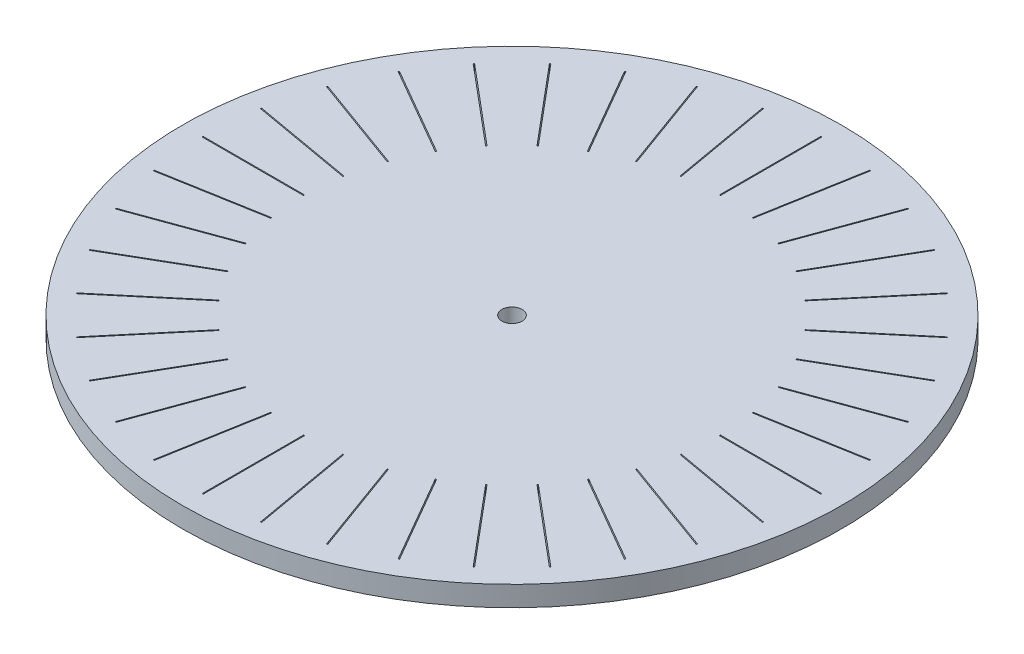
from build123d import *

# Parameters (mm, degrees)
SKETCH1_R           = 82.55
SKETCH1_R_2         = 2.54
SKETCH1_W           = 0.254
SKETCH1_H           = 25.4
SKETCH1_W_2         = 25.4
SKETCH1_H_2         = 0.254
BOSS_EXTRUDE1_DEPTH = 5.08


with BuildPart() as part:
    # Sketch1 → Boss-Extrude1 (new body)
    with BuildSketch(Plane(origin=(0, 0, 0), x_dir=(1, 0, 0), z_dir=(0, 1, 0))):
        with Locations(Location((0, 0, 0), (0, 0, 270))):
            Circle(SKETCH1_R)
        with Locations(Location((0, 0, 0), (0, 0, 270))):
            Circle(SKETCH1_R_2, mode=Mode.SUBTRACT)
        Polygon((13.327453739, 76.315109944), (13.577594908, 76.271003307), (9.166931196, 51.256886381), (8.916790026, 51.300993018), align=None, mode=Mode.SUBTRACT)
        with Locations((0, 64.77)):
            Rectangle(SKETCH1_W, SKETCH1_H, mode=Mode.SUBTRACT)
        Polygon((26.376959541, 72.84142389), (26.615641466, 72.754550774), (17.928329826, 48.886358206), (17.6896479, 48.973231323), align=None, mode=Mode.SUBTRACT)
        Polygon((38.625014774, 67.154488031), (38.844985226, 67.027488031), (26.144985226, 45.030442775), (25.925014774, 45.157442775), align=None, mode=Mode.SUBTRACT)
        Polygon((49.699468478, 59.427097035), (49.894043767, 59.263828982), (33.567238481, 39.806300127), (33.372663192, 39.96956818), align=None, mode=Mode.SUBTRACT)
        Polygon((59.263828982, 49.894043767), (59.427097035, 49.699468478), (39.96956818, 33.372663192), (39.806300127, 33.567238481), align=None, mode=Mode.SUBTRACT)
        Polygon((67.027488031, 38.844985226), (67.154488031, 38.625014774), (45.157442775, 25.925014774), (45.030442775, 26.144985226), align=None, mode=Mode.SUBTRACT)
        Polygon((72.754550774, 26.615641466), (72.84142389, 26.376959541), (48.973231323, 17.6896479), (48.886358206, 17.928329826), align=None, mode=Mode.SUBTRACT)
        Polygon((76.271003307, 13.577594908), (76.315109944, 13.327453739), (51.300993018, 8.916790026), (51.256886381, 9.166931196), align=None, mode=Mode.SUBTRACT)
        with Locations((64.77, 0)):
            Rectangle(SKETCH1_W_2, SKETCH1_H_2, mode=Mode.SUBTRACT)
        Polygon((76.315109944, -13.327453739), (76.271003307, -13.577594908), (51.256886381, -9.166931196), (51.300993018, -8.916790026), align=None, mode=Mode.SUBTRACT)
        Polygon((72.84142389, -26.376959541), (72.754550774, -26.615641466), (48.886358206, -17.928329826), (48.973231323, -17.6896479), align=None, mode=Mode.SUBTRACT)
        Polygon((67.154488031, -38.625014774), (67.027488031, -38.844985226), (45.030442775, -26.144985226), (45.157442775, -25.925014774), align=None, mode=Mode.SUBTRACT)
        Polygon((59.427097035, -49.699468478), (59.263828982, -49.894043767), (39.806300127, -33.567238481), (39.96956818, -33.372663192), align=None, mode=Mode.SUBTRACT)
        Polygon((49.894043767, -59.263828982), (49.699468478, -59.427097035), (33.372663192, -39.96956818), (33.567238481, -39.806300127), align=None, mode=Mode.SUBTRACT)
        Polygon((38.844985226, -67.027488031), (38.625014774, -67.154488031), (25.925014774, -45.157442775), (26.144985226, -45.030442775), align=None, mode=Mode.SUBTRACT)
        Polygon((26.615641466, -72.754550774), (26.376959541, -72.84142389), (17.6896479, -48.973231323), (17.928329826, -48.886358206), align=None, mode=Mode.SUBTRACT)
        Polygon((13.577594908, -76.271003307), (13.327453739, -76.315109944), (8.916790026, -51.300993018), (9.166931196, -51.256886381), align=None, mode=Mode.SUBTRACT)
        with Locations((0, -64.77)):
            Rectangle(SKETCH1_W, SKETCH1_H, mode=Mode.SUBTRACT)
        Polygon((-13.327453739, -76.315109944), (-13.577594908, -76.271003307), (-9.166931196, -51.256886381), (-8.916790026, -51.300993018), align=None, mode=Mode.SUBTRACT)
        Polygon((-26.376959541, -72.84142389), (-26.615641466, -72.754550774), (-17.928329826, -48.886358206), (-17.6896479, -48.973231323), align=None, mode=Mode.SUBTRACT)
        Polygon((-38.625014774, -67.154488031), (-38.844985226, -67.027488031), (-26.144985226, -45.030442775), (-25.925014774, -45.157442775), align=None, mode=Mode.SUBTRACT)
        Polygon((-49.699468478, -59.427097035), (-49.894043767, -59.263828982), (-33.567238481, -39.806300127), (-33.372663192, -39.96956818), align=None, mode=Mode.SUBTRACT)
        Polygon((-59.263828982, -49.894043767), (-59.427097035, -49.699468478), (-39.96956818, -33.372663192), (-39.806300127, -33.567238481), align=None, mode=Mode.SUBTRACT)
        Polygon((-67.027488031, -38.844985226), (-67.154488031, -38.625014774), (-45.157442775, -25.925014774), (-45.030442775, -26.144985226), align=None, mode=Mode.SUBTRACT)
        Polygon((-72.754550774, -26.615641466), (-72.84142389, -26.376959541), (-48.973231323, -17.6896479), (-48.886358206, -17.928329826), align=None, mode=Mode.SUBTRACT)
        Polygon((-76.271003307, -13.577594908), (-76.315109944, -13.327453739), (-51.300993018, -8.916790026), (-51.256886381, -9.166931196), align=None, mode=Mode.SUBTRACT)
        with Locations((-64.77, 0)):
            Rectangle(SKETCH1_W_2, SKETCH1_H_2, mode=Mode.SUBTRACT)
        Polygon((-76.315109944, 13.327453739), (-76.271003307, 13.577594908), (-51.256886381, 9.166931196), (-51.300993018, 8.916790026), align=None, mode=Mode.SUBTRACT)
        Polygon((-72.84142389, 26.376959541), (-72.754550774, 26.615641466), (-48.886358206, 17.928329826), (-48.973231323, 17.6896479), align=None, mode=Mode.SUBTRACT)
        Polygon((-67.154488031, 38.625014774), (-67.027488031, 38.844985226), (-45.030442775, 26.144985226), (-45.157442775, 25.925014774), align=None, mode=Mode.SUBTRACT)
        Polygon((-59.427097035, 49.699468478), (-59.263828982, 49.894043767), (-39.806300127, 33.567238481), (-39.96956818, 33.372663192), align=None, mode=Mode.SUBTRACT)
        Polygon((-49.894043767, 59.263828982), (-49.699468478, 59.427097035), (-33.372663192, 39.96956818), (-33.567238481, 39.806300127), align=None, mode=Mode.SUBTRACT)
        Polygon((-38.844985226, 67.027488031), (-38.625014774, 67.154488031), (-25.925014774, 45.157442775), (-26.144985226, 45.030442775), align=None, mode=Mode.SUBTRACT)
        Polygon((-26.615641466, 72.754550774), (-26.376959541, 72.84142389), (-17.6896479, 48.973231323), (-17.928329826, 48.886358206), align=None, mode=Mode.SUBTRACT)
        Polygon((-13.577594908, 76.271003307), (-13.327453739, 76.315109944), (-8.916790026, 51.300993018), (-9.166931196, 51.256886381), align=None, mode=Mode.SUBTRACT)
    extrude(amount=BOSS_EXTRUDE1_DEPTH)


solid = part.part
